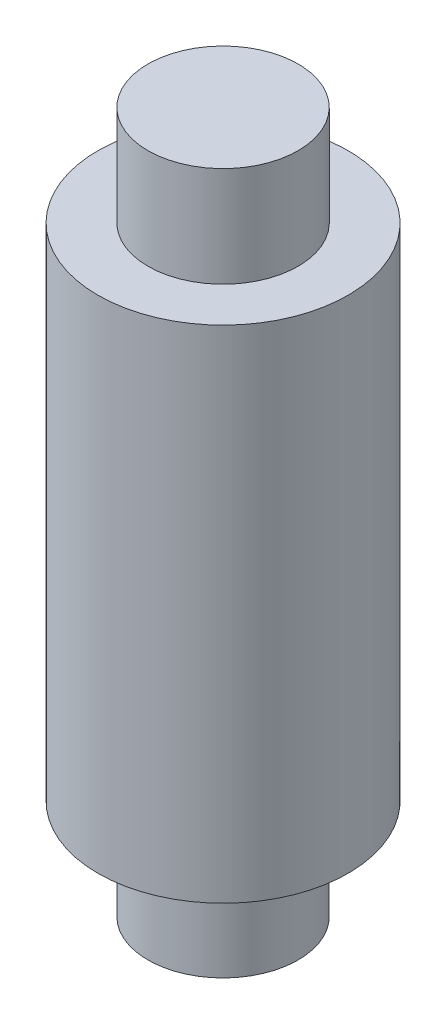
from build123d import *

# Parameters (mm, degrees)
SKETCH_1_R      = 2.5
EXTRUDE_1_DEPTH = 10
SKETCH_2_R      = 1.5
EXTRUDE_2_DEPTH = 2
EXTRUDE_START   = 2
SKETCH_4_R      = 1.5
EXTRUDE_3_DEPTH = 2


with BuildPart() as part:
    # Эскиз1 → Бобышка-Вытянуть1 (new body)
    with BuildSketch(Plane(origin=(0, 0, 0), x_dir=(1, 0, 0), z_dir=(0, 1, 0))):
        with Locations(Location((0, 0, 0), (0, 0, 270))):
            Circle(SKETCH_1_R)
    extrude(amount=EXTRUDE_1_DEPTH)

    # Эскиз2 → Бобышка-Вытянуть2 (add)
    with BuildSketch(Plane(origin=(0, 10, 0), x_dir=(1, 0, 0), z_dir=(0, 1, 0))):
        with Locations(Location((0, 0, 0), (0, 0, 270))):
            Circle(SKETCH_2_R)
    extrude(amount=EXTRUDE_2_DEPTH)

    # Эскиз4 → Бобышка-Вытянуть3 (add)
    with BuildSketch(Plane.XZ.offset(EXTRUDE_START)):
        with Locations(Location((0, 0, 0), (0, 0, 90))):
            Circle(SKETCH_4_R)
    extrude(amount=-EXTRUDE_3_DEPTH)


solid = part.part
